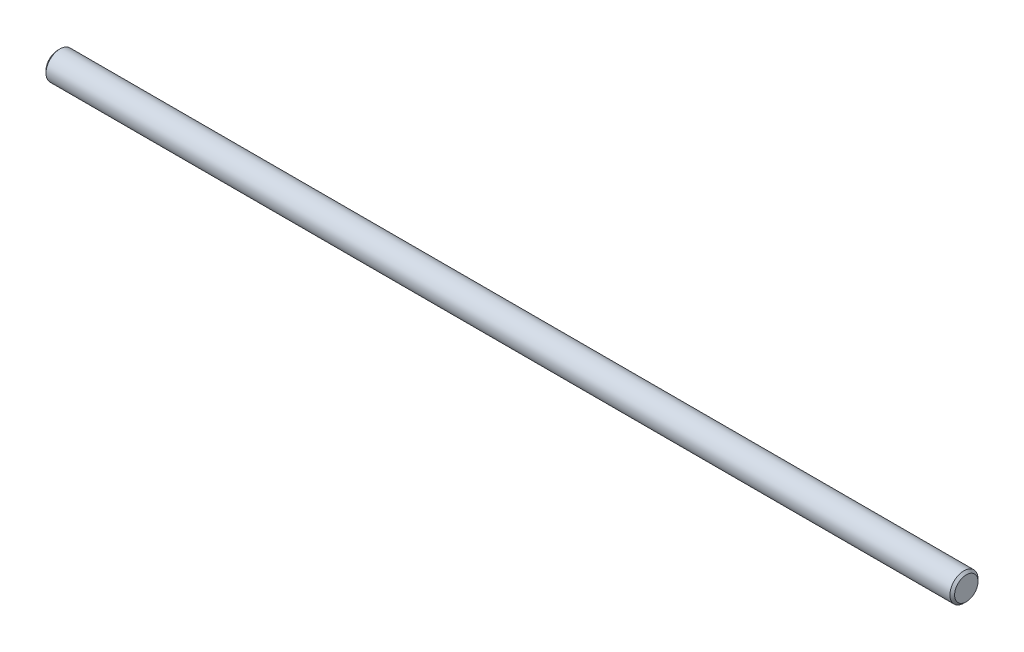
from build123d import *

# Parameters (mm, degrees)
SKETCH1_R           = 6
BOSS_EXTRUDE1_DEPTH = 388
CHAMFER1_SIZE       = 1


with BuildPart() as part:
    # Sketch1 → Boss-Extrude1 (new body)
    with BuildSketch(Plane(origin=(0, 0, 0), x_dir=(0, 0, -1), z_dir=(1, 0, 0))):
        with Locations(Location((0, 0, 0), (0, 0, 180))):
            Circle(SKETCH1_R)
    extrude(amount=BOSS_EXTRUDE1_DEPTH)

    # Chamfer1
    chamfer1_edges = [part.edges().sort_by_distance(p)[0] for p in [
        (0, 0, -6),
        (388, 0, -6),
    ]]
    chamfer(chamfer1_edges, length=CHAMFER1_SIZE)


solid = part.part
